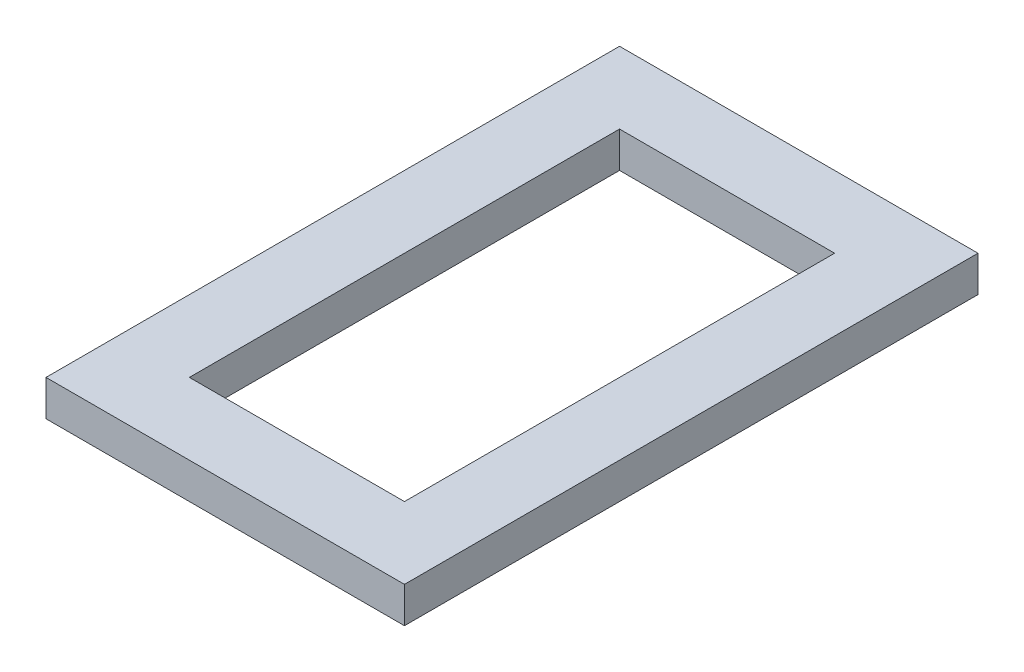
from build123d import *

# Parameters (mm, degrees)
SKETCH1_W           = 63.5
SKETCH1_H           = 101.6
BOSS_EXTRUDE1_DEPTH = 6.35
SKETCH2_W           = 38.1
SKETCH2_H           = 76.2
CUT_EXTRUDE1_DEPTH  = 120.979717036


with BuildPart() as part:
    # Sketch1 → Boss-Extrude1 (new body)
    with BuildSketch(Plane(origin=(0, 0, 0), x_dir=(1, 0, 0), z_dir=(0, 1, 0))):
        with Locations((-31.75, 50.8)):
            Rectangle(SKETCH1_W, SKETCH1_H)
    extrude(amount=BOSS_EXTRUDE1_DEPTH)

    # Sketch2 → Cut-Extrude1 (cut, through all)
    with BuildSketch(Plane(origin=(0, 6.35, 0), x_dir=(1, 0, 0), z_dir=(0, 1, 0))):
        with Locations((-31.75, 50.8)):
            Rectangle(SKETCH2_W, SKETCH2_H)
    extrude(amount=-CUT_EXTRUDE1_DEPTH, mode=Mode.SUBTRACT)


solid = part.part
